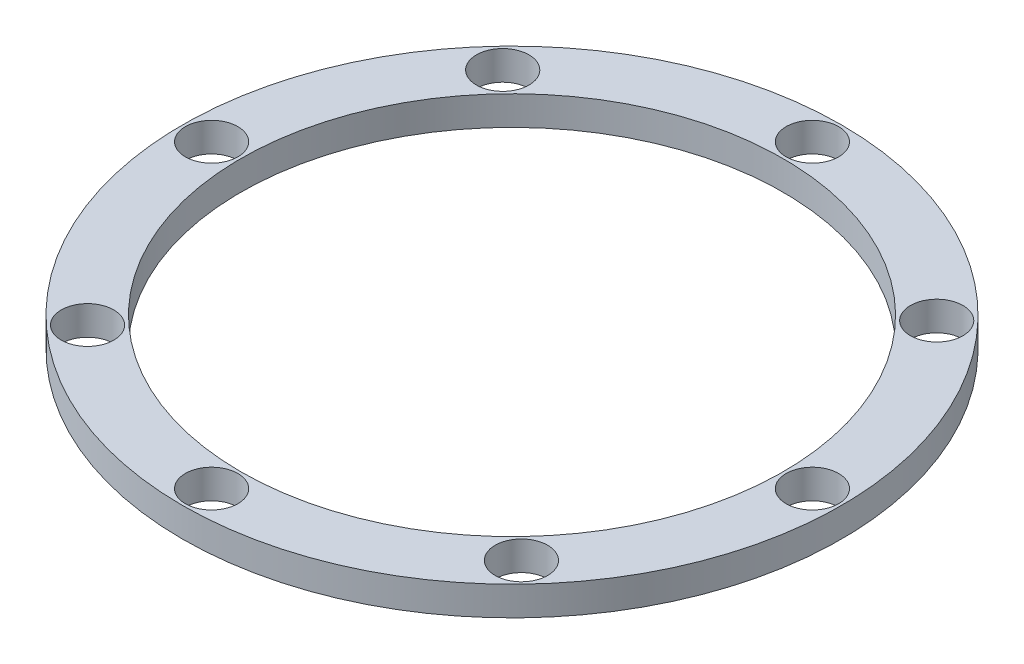
from build123d import *

# Parameters (mm, degrees)
BOSS_EXTRUDE1_DEPTH = 5


with BuildPart() as part:
    # Sketch1 → Boss-Extrude1 (new body)
    with BuildSketch(Plane(origin=(0, 0, 0), x_dir=(1, 0, 0), z_dir=(0, 1, 0))):
        with BuildLine():
            ThreePointArc((0, -56.5), (22.199372282, -51.95611485), (40.828075606, -39.055322843))
            Line((40.828075606, -39.055322843), (40.466765202, -38.709700517))
            ThreePointArc((40.466765202, -38.709700517), (34.104370635, -38.850893215), (33.963177937, -32.488498648))
            Line((33.963177937, -32.488498648), (33.601867534, -32.142876322))
            ThreePointArc((33.601867534, -32.142876322), (18.270279842, -42.76034231), (0, -46.5))
            Line((0, -46.5), (0, -47))
            ThreePointArc((0, -47), (3.181980515, -48.318019485), (4.5, -51.5))
            ThreePointArc((4.5, -51.5), (3.181980515, -54.681980515), (0, -56))
            Line((0, -56), (0, -56.5))
        make_face()
        with BuildLine():
            ThreePointArc((40.828075606, -39.055322843), (52.435847813, -21.041194456), (56.5, 0))
            Line((56.5, 0), (56, 0))
            ThreePointArc((56, 0), (51.5, -4.5), (47, 0))
            Line((47, 0), (46.5, 0))
            ThreePointArc((46.5, 0), (43.155166784, -17.317089243), (33.601867534, -32.142876322))
            Line((33.601867534, -32.142876322), (33.963177937, -32.488498648))
            ThreePointArc((33.963177937, -32.488498648), (38.890818916, -31.422793119), (41.71497157, -35.599099582))
            ThreePointArc((41.71497157, -35.599099582), (41.391278033, -37.274946928), (40.466765202, -38.709700517))
            Line((40.466765202, -38.709700517), (40.828075606, -39.055322843))
        make_face()
        with BuildLine():
            ThreePointArc((56.5, 0), (52.435847813, 21.041194456), (40.828075606, 39.055322843))
            Line((40.828075606, 39.055322843), (40.466765202, 38.709700517))
            ThreePointArc((40.466765202, 38.709700517), (41.391278033, 37.274946928), (41.71497157, 35.599099582))
            ThreePointArc((41.71497157, 35.599099582), (38.890818916, 31.422793119), (33.963177937, 32.488498648))
            Line((33.963177937, 32.488498648), (33.601867534, 32.142876322))
            ThreePointArc((33.601867534, 32.142876322), (43.155166784, 17.317089243), (46.5, 0))
            Line((46.5, 0), (47, 0))
            ThreePointArc((47, 0), (51.5, 4.5), (56, 0))
            Line((56, 0), (56.5, 0))
        make_face()
        with BuildLine():
            ThreePointArc((40.828075606, 39.055322843), (22.199372282, 51.95611485), (0, 56.5))
            Line((0, 56.5), (0, 56))
            ThreePointArc((0, 56), (3.181980515, 54.681980515), (4.5, 51.5))
            ThreePointArc((4.5, 51.5), (3.181980515, 48.318019485), (0, 47))
            Line((0, 47), (0, 46.5))
            ThreePointArc((0, 46.5), (18.270279842, 42.76034231), (33.601867534, 32.142876322))
            Line((33.601867534, 32.142876322), (33.963177937, 32.488498648))
            ThreePointArc((33.963177937, 32.488498648), (34.104370635, 38.850893215), (40.466765202, 38.709700517))
            Line((40.466765202, 38.709700517), (40.828075606, 39.055322843))
        make_face()
        with BuildLine():
            Line((0, 56), (0, 56.5))
            ThreePointArc((0, 56.5), (-22.190806646, 51.959773868), (-40.815196293, 39.068782315))
            Line((-40.815196293, 39.068782315), (-40.453999865, 38.723040879))
            ThreePointArc((-40.453999865, 38.723040879), (-35.526696202, 39.787398082), (-32.703232019, 35.611367951))
            ThreePointArc((-32.703232019, 35.611367951), (-33.027201888, 33.934832134), (-33.952464173, 32.499695023))
            Line((-33.952464173, 32.499695023), (-33.591267745, 32.153953587))
            ThreePointArc((-33.591267745, 32.153953587), (-18.263230248, 42.763353714), (0, 46.5))
            Line((0, 46.5), (0, 47))
            ThreePointArc((0, 47), (-4.5, 51.5), (0, 56))
        make_face()
        with BuildLine():
            Line((-40.453999865, 38.723040879), (-40.815196293, 39.068782315))
            ThreePointArc((-40.815196293, 39.068782315), (-52.43237831, 21.049838592), (-56.5, 0))
            Line((-56.5, 0), (-56, 0))
            ThreePointArc((-56, 0), (-51.5, 4.5), (-47, 0))
            Line((-47, 0), (-46.5, 0))
            ThreePointArc((-46.5, 0), (-43.152311353, 17.324203443), (-33.591267745, 32.153953587))
            Line((-33.591267745, 32.153953587), (-33.952464173, 32.499695023))
            ThreePointArc((-33.952464173, 32.499695023), (-40.314904947, 32.360600105), (-40.453999865, 38.723040879))
        make_face()
        with BuildLine():
            Line((-56, 0), (-56.5, 0))
            ThreePointArc((-56.5, 0), (-51.753754464, -22.667132569), (-38.312428358, -41.525989854))
            Line((-38.312428358, -41.525989854), (-37.973380319, -41.158503218))
            ThreePointArc((-37.973380319, -41.158503218), (-38.229327695, -34.799691148), (-31.870515625, -34.543743772))
            Line((-31.870515625, -34.543743772), (-31.531467586, -34.176257136))
            ThreePointArc((-31.531467586, -34.176257136), (-42.593797922, -18.655250698), (-46.5, 0))
            Line((-46.5, 0), (-47, 0))
            ThreePointArc((-47, 0), (-51.5, -4.5), (-56, 0))
        make_face()
        with BuildLine():
            Line((-37.973380319, -41.158503218), (-38.312428358, -41.525989854))
            ThreePointArc((-38.312428358, -41.525989854), (-20.567347584, -52.623513883), (0, -56.5))
            Line((0, -56.5), (0, -56))
            ThreePointArc((0, -56), (-4.5, -51.5), (0, -47))
            Line((0, -47), (0, -46.5))
            ThreePointArc((0, -46.5), (-16.927109073, -43.30961762), (-31.531467586, -34.176257136))
            Line((-31.531467586, -34.176257136), (-31.870515625, -34.543743772))
            ThreePointArc((-31.870515625, -34.543743772), (-30.799967528, -36.045776653), (-30.421947972, -37.851123495))
            ThreePointArc((-30.421947972, -37.851123495), (-33.11660113, -41.973103939), (-37.973380319, -41.158503218))
        make_face()
    extrude(amount=BOSS_EXTRUDE1_DEPTH)


solid = part.part
